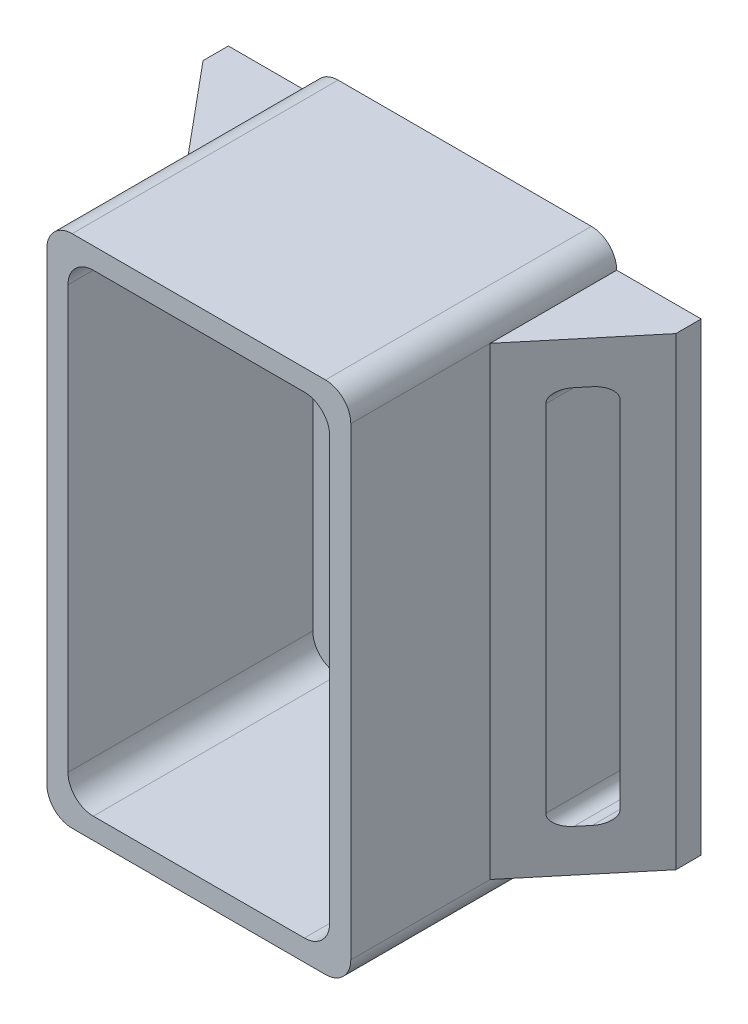
from build123d import *

# Parameters (mm, degrees)
SHELL_DEPTH         = 29
BOTTOM_START        = 2.5
BOTTOM_COVER_DEPTH  = 2.5
BOSS_EXTRUDE4_DEPTH = 55
CUT_EXTRUDE1_DEPTH  = 64


with BuildPart() as part:
    # Sketch1 → Shell (new body)
    with BuildSketch(Plane.XY):
        with BuildLine():
            Line((-14.99046496, 38.43538022), (15.00953504, 38.43538022))
            ThreePointArc((15.00953504, 38.43538022), (17.130855384, 37.556700564), (18.00953504, 35.43538022))
            Line((18.00953504, 35.43538022), (18.00953504, -19.56461978))
            ThreePointArc((18.00953504, -19.56461978), (17.130855384, -21.685940124), (15.00953504, -22.56461978))
            Line((15.00953504, -22.56461978), (-14.99046496, -22.56461978))
            ThreePointArc((-14.99046496, -22.56461978), (-17.111785303, -21.685940124), (-17.99046496, -19.56461978))
            Line((-17.99046496, -19.56461978), (-17.99046496, 35.43538022))
            ThreePointArc((-17.99046496, 35.43538022), (-17.111785303, 37.556700564), (-14.99046496, 38.43538022))
        make_face()
        with BuildLine():
            Line((-12.49046496, 35.93538022), (12.50953504, 35.93538022))
            ThreePointArc((12.50953504, 35.93538022), (14.630855384, 35.056700564), (15.50953504, 32.93538022))
            Line((15.50953504, 32.93538022), (15.50953504, -17.06461978))
            ThreePointArc((15.50953504, -17.06461978), (14.630855384, -19.185940124), (12.50953504, -20.06461978))
            Line((12.50953504, -20.06461978), (-12.49046496, -20.06461978))
            ThreePointArc((-12.49046496, -20.06461978), (-14.611785303, -19.185940124), (-15.49046496, -17.06461978))
            Line((-15.49046496, -17.06461978), (-15.49046496, 32.93538022))
            ThreePointArc((-15.49046496, 32.93538022), (-14.611785303, 35.056700564), (-12.49046496, 35.93538022))
        make_face(mode=Mode.SUBTRACT)
    extrude(amount=SHELL_DEPTH)

    # Sketch3 → Bottom cover (add)
    with BuildSketch(Plane(origin=(0, 0, 0), x_dir=(-1, 0, 0), z_dir=(0, 0, -1)).offset(BOTTOM_START)):
        with BuildLine():
            Line((-15.00953504, 38.43538022), (14.99046496, 38.43538022))
            ThreePointArc((14.99046496, 38.43538022), (17.111785303, 37.556700564), (17.99046496, 35.43538022))
            Line((17.99046496, 35.43538022), (17.99046496, -19.56461978))
            ThreePointArc((17.99046496, -19.56461978), (17.111785303, -21.685940124), (14.99046496, -22.56461978))
            Line((14.99046496, -22.56461978), (-15.00953504, -22.56461978))
            ThreePointArc((-15.00953504, -22.56461978), (-17.130855384, -21.685940124), (-18.00953504, -19.56461978))
            Line((-18.00953504, -19.56461978), (-18.00953504, 35.43538022))
            ThreePointArc((-18.00953504, 35.43538022), (-17.130855384, 37.556700564), (-15.00953504, 38.43538022))
        make_face()
    extrude(amount=-BOTTOM_COVER_DEPTH)


with BuildPart() as boss_extrude4_tool:
    # 3DSketch1 → Boss-Extrude4 (new body)
    with BuildSketch(Plane(origin=(18.009536245, 35.43538022, -2.500000038), x_dir=(-0.99788010602318, 0, 0.06507913646605183), z_dir=(0, 1, 0))):
        Polygon((0, 0), (-9.97880106, 0.650791365), (-9.783563651, 3.644431683), (0.976187047, 14.96820159), align=None)
        Polygon((35.923685021, -2.342848953), (45.902486082, -2.993640318), (46.097723491, 0), (36.899872068, 12.625352637), align=None)
    extrude(amount=-BOSS_EXTRUDE4_DEPTH)


with BuildPart() as part_1:
    add(part.part)


with BuildPart() as part_2:
    # Boss-Extrude4: joined with boss_extrude4_tool
    add(part_1.part.fuse(boss_extrude4_tool.part, tol=0.00001))

    # Sketch9 → Cut-Extrude1 (cut)
    with BuildSketch(Plane(origin=(0, 0, -2.5), x_dir=(-1, 0, 0), z_dir=(0, 0, -1))):
        with BuildLine():
            Line((-23.50953504, -14.56461978), (-22.50953504, -14.56461978))
            ThreePointArc((-22.50953504, -14.56461978), (-21.448874869, -14.125279952), (-21.00953504, -13.06461978))
            Line((-21.00953504, -13.06461978), (-21.00953504, 28.93538022))
            ThreePointArc((-21.00953504, 28.93538022), (-21.448874869, 29.996040392), (-22.50953504, 30.43538022))
            Line((-22.50953504, 30.43538022), (-23.50953504, 30.43538022))
            ThreePointArc((-23.50953504, 30.43538022), (-24.570195212, 29.996040392), (-25.00953504, 28.93538022))
            Line((-25.00953504, 28.93538022), (-25.00953504, -13.06461978))
            ThreePointArc((-25.00953504, -13.06461978), (-24.570195212, -14.125279952), (-23.50953504, -14.56461978))
        make_face()
        with BuildLine():
            Line((22.49046496, 30.43538022), (23.49046496, 30.43538022))
            ThreePointArc((23.49046496, 30.43538022), (24.551125131, 29.996040392), (24.99046496, 28.93538022))
            Line((24.99046496, 28.93538022), (24.99046496, -13.06461978))
            ThreePointArc((24.99046496, -13.06461978), (24.551125131, -14.125279952), (23.49046496, -14.56461978))
            Line((23.49046496, -14.56461978), (22.49046496, -14.56461978))
            ThreePointArc((22.49046496, -14.56461978), (21.429804788, -14.125279952), (20.99046496, -13.06461978))
            Line((20.99046496, -13.06461978), (20.99046496, 28.93538022))
            ThreePointArc((20.99046496, 28.93538022), (21.429804788, 29.996040392), (22.49046496, 30.43538022))
        make_face()
    extrude(amount=-CUT_EXTRUDE1_DEPTH, mode=Mode.SUBTRACT)


solid = part_2.part
